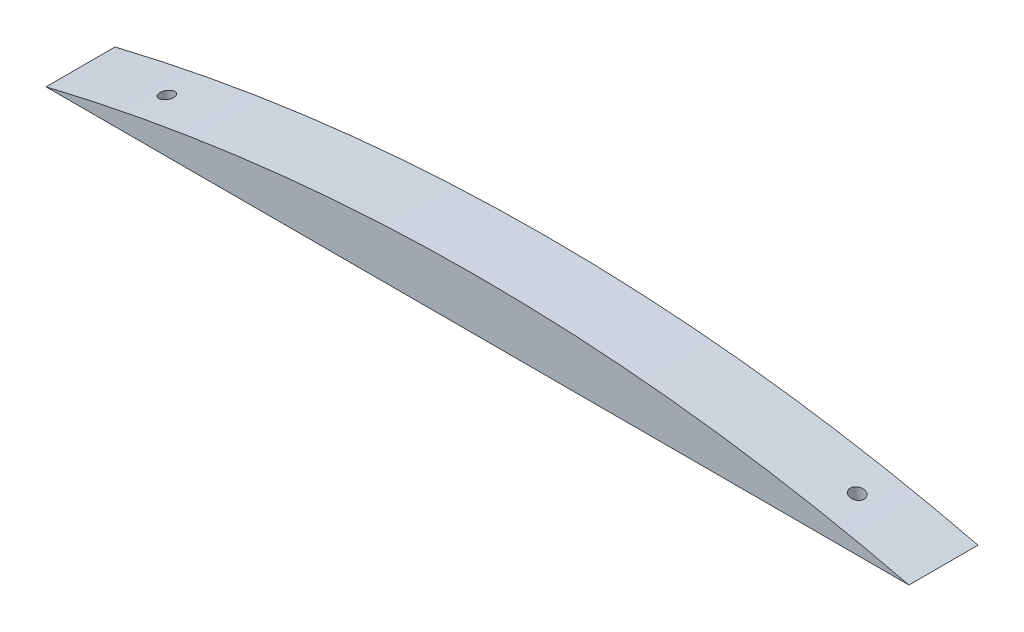
from build123d import *

# Parameters (mm, degrees)
BOSS_EXTRUDE3_DEPTH = 25.4
SKETCH2_R           = 4.7625
CUT_EXTRUDE1_DEPTH  = 25.4
SKETCH3_R           = 2.5527
CUT_EXTRUDE2_DEPTH  = 12.7


with BuildPart() as part:
    # Sketch1 → Boss-Extrude3 (new body)
    with BuildSketch(Plane.XY):
        with BuildLine():
            ThreePointArc((-158.75, 0), (0, 19.015868295), (158.75, 0))
            Line((158.75, 0), (-158.75, 0))
        make_face()
    extrude(amount=BOSS_EXTRUDE3_DEPTH)

    # Sketch2 → Cut-Extrude1 (cut)
    with BuildSketch(Plane.XZ):
        with Locations((-180.975, 12.7)):
            Circle(SKETCH2_R)
        with Locations((180.975, 12.7)):
            Circle(SKETCH2_R)
    extrude(amount=-CUT_EXTRUDE1_DEPTH, mode=Mode.SUBTRACT)

    # Sketch3 → Cut-Extrude2 (cut)
    with BuildSketch(Plane.XZ):
        with Locations(Location((-127, 12.7, 0), (0, 0, 270))):
            Circle(SKETCH3_R)
        with Locations(Location((127, 12.7, 0), (0, 0, 270))):
            Circle(SKETCH3_R)
    extrude(amount=-CUT_EXTRUDE2_DEPTH, mode=Mode.SUBTRACT)


solid = part.part
